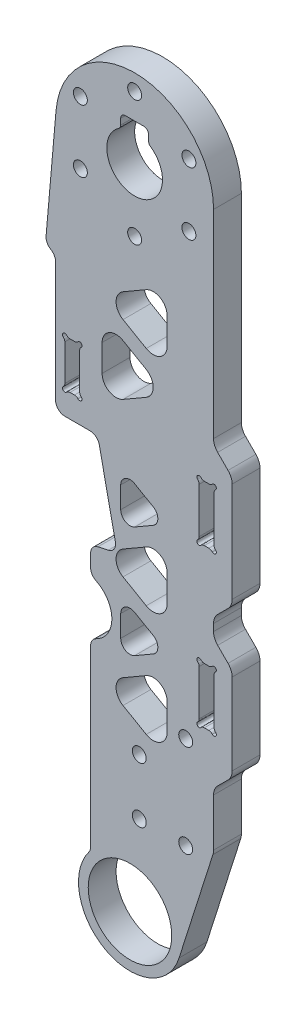
from build123d import *

# Parameters (mm, degrees)
SKETCH_1_R      = 1.5
SKETCH_1_R_2    = 9
EXTRUDE_1_DEPTH = 6


with BuildPart() as part:
    # 草图1 → 凸台-拉伸1 (new body)
    with BuildSketch(Plane(origin=(0, 0, 0), x_dir=(-1, 0, 0), z_dir=(0, 0, -1))):
        with BuildLine():
            Line((32.955703333, 64.324893425), (30.80974204, 88.853343236))
            ThreePointArc((30.80974204, 88.853343236), (13.132902588, 104.355515376), (-3.125567827, 87.371695609))
            Line((-3.125567827, 87.371695609), (-3.125567827, 44.614336296))
            ThreePointArc((-3.125567827, 44.614336296), (-3.35392923, 43.466285999), (-4.004247484, 42.493015952))
            Line((-4.004247484, 42.493015952), (-6.246888171, 40.250375265))
            ThreePointArc((-6.246888171, 40.250375265), (-6.897206425, 39.277105219), (-7.125567827, 38.129054922))
            Line((-7.125567827, 38.129054922), (-7.125567827, 16.614336296))
            ThreePointArc((-7.125567827, 16.614336296), (-6.897206425, 15.466285999), (-6.246888171, 14.493015952))
            Line((-6.246888171, 14.493015952), (-4.004247484, 12.250375265))
            ThreePointArc((-4.004247484, 12.250375265), (-3.35392923, 11.277105219), (-3.125567827, 10.129054922))
            Line((-3.125567827, 10.129054922), (-3.125567827, 8.614336296))
            ThreePointArc((-3.125567827, 8.614336296), (-3.35392923, 7.466285999), (-4.004247484, 6.493015952))
            Line((-4.004247484, 6.493015952), (-6.246888171, 4.250375265))
            ThreePointArc((-6.246888171, 4.250375265), (-6.897206425, 3.277105219), (-7.125567827, 2.129054922))
            Line((-7.125567827, 2.129054922), (-7.125567827, -15.385663704))
            ThreePointArc((-7.125567827, -15.385663704), (-6.897206425, -16.533714001), (-6.246888171, -17.506984048))
            Line((-6.246888171, -17.506984048), (-4.004247484, -19.749624735))
            ThreePointArc((-4.004247484, -19.749624735), (-3.35392923, -20.722894781), (-3.125567827, -21.870945078))
            Line((-3.125567827, -21.870945078), (-3.125567827, -32.162875903))
            ThreePointArc((-3.125567827, -32.162875903), (-3.090102825, -32.62280225), (-2.98454633, -33.071854406))
            Line((-2.98454633, -33.071854406), (4.301916011, -55.989711238))
            ThreePointArc((4.301916011, -55.989711238), (19.95472423, -62.490747628), (23.749643638, -45.971895792))
            ThreePointArc((23.749643638, -45.971895792), (23.452277042, -45.404351324), (23.349643638, -44.771895792))
            Line((23.349643638, -44.771895792), (23.349643638, -7.198720147))
            ThreePointArc((23.349643638, -7.198720147), (23.040438051, -6.130443847), (22.208429387, -5.392484548))
            ThreePointArc((22.208429387, -5.392484548), (18.784786633, 0.026222248), (22.208429387, 5.444929044))
            ThreePointArc((22.208429387, 5.444929044), (23.040438051, 6.182888343), (23.349643638, 7.251164643))
            Line((23.349643638, 7.251164643), (23.349643638, 10.023932997))
            ThreePointArc((23.349643638, 10.023932997), (22.903935561, 11.28257378), (21.765467019, 11.980228199))
            Line((21.765467019, 11.980228199), (19.563528405, 12.4482647))
            ThreePointArc((19.563528405, 12.4482647), (18.30201065, 13.315281831), (18.023056585, 14.820383283))
            Line((18.023056585, 14.820383283), (21.500946505, 31.182568919))
            ThreePointArc((21.500946505, 31.182568919), (22.198600924, 32.32103746), (23.457241706, 32.766745537))
            Line((23.457241706, 32.766745537), (28.907131585, 32.766745537))
            ThreePointArc((28.907131585, 32.766745537), (30.321345148, 33.352531975), (30.907131585, 34.766745537))
            Line((30.907131585, 34.766745537), (30.907131585, 60.619918005))
            ThreePointArc((30.907131585, 60.619918005), (31.129655766, 61.536749347), (31.747711296, 62.249563547))
            ThreePointArc((31.747711296, 62.249563547), (31.948812633, 62.393857493), (32.148749116, 62.539761206))
            ThreePointArc((32.148749116, 62.539761206), (32.785761883, 63.326759457), (32.955703333, 64.324893425))
        make_face()
        with Locations((13.874432173, 100.871695609)):
            Circle(SKETCH_1_R, mode=Mode.SUBTRACT)
        with Locations((2.183089222, 94.121695609)):
            Circle(SKETCH_1_R, mode=Mode.SUBTRACT)
        with Locations((2.183089222, 80.621695609)):
            Circle(SKETCH_1_R, mode=Mode.SUBTRACT)
        with Locations((13.874432173, 73.871695609)):
            Circle(SKETCH_1_R, mode=Mode.SUBTRACT)
        with Locations((25.565775124, 80.621695609)):
            Circle(SKETCH_1_R, mode=Mode.SUBTRACT)
        with Locations((12.874432173, -22.332303749)):
            Circle(SKETCH_1_R, mode=Mode.SUBTRACT)
        with Locations((2.874432173, -14.332303749)):
            Circle(SKETCH_1_R, mode=Mode.SUBTRACT)
        with Locations((12.874432173, -34.332303749)):
            Circle(SKETCH_1_R, mode=Mode.SUBTRACT)
        with Locations((2.874432173, -34.332303749)):
            Circle(SKETCH_1_R, mode=Mode.SUBTRACT)
        with Locations((14.874432173, -52.628304391)):
            Circle(SKETCH_1_R_2, mode=Mode.SUBTRACT)
        with Locations((25.565775124, 94.121695609)):
            Circle(SKETCH_1_R, mode=Mode.SUBTRACT)
        with BuildLine():
            Line((-2.107533838, 35.667696251), (-1.143601816, 35.667696251))
            ThreePointArc((-1.143601816, 35.667696251), (-0.735353525, 35.754825322), (-0.398245823, 36.001029585))
            ThreePointArc((-0.398245823, 36.001029585), (0.327985563, 36.021249642), (0.307765506, 35.295018255))
            ThreePointArc((0.307765506, 35.295018255), (0.061561244, 34.957910553), (-0.025567827, 34.549662262))
            Line((-0.025567827, 34.549662262), (-0.025567827, 24.78573024))
            ThreePointArc((-0.025567827, 24.78573024), (0.061561244, 24.377481949), (0.307765506, 24.040374247))
            ThreePointArc((0.307765506, 24.040374247), (0.327985563, 23.314142861), (-0.398245823, 23.334362918))
            ThreePointArc((-0.398245823, 23.334362918), (-0.735353525, 23.58056718), (-1.143601816, 23.667696251))
            Line((-1.143601816, 23.667696251), (-2.107533838, 23.667696251))
            ThreePointArc((-2.107533838, 23.667696251), (-2.515782129, 23.58056718), (-2.852889831, 23.334362918))
            ThreePointArc((-2.852889831, 23.334362918), (-3.579121218, 23.314142861), (-3.558901161, 24.040374247))
            ThreePointArc((-3.558901161, 24.040374247), (-3.312696898, 24.377481949), (-3.225567827, 24.78573024))
            Line((-3.225567827, 24.78573024), (-3.225567827, 34.549662262))
            ThreePointArc((-3.225567827, 34.549662262), (-3.312696898, 34.957910553), (-3.558901161, 35.295018255))
            ThreePointArc((-3.558901161, 35.295018255), (-3.579121218, 36.021249642), (-2.852889831, 36.001029585))
            ThreePointArc((-2.852889831, 36.001029585), (-2.515782129, 35.754825322), (-2.107533838, 35.667696251))
        make_face(mode=Mode.SUBTRACT)
        with BuildLine():
            Line((10.874432173, 93.116258255), (10.874432173, 94.371695609))
            ThreePointArc((10.874432173, 94.371695609), (11.167325392, 95.07880239), (11.874432173, 95.371695609))
            Line((11.874432173, 95.371695609), (15.874432173, 95.371695609))
            ThreePointArc((15.874432173, 95.371695609), (16.581538954, 95.07880239), (16.874432173, 94.371695609))
            Line((16.874432173, 94.371695609), (16.874432173, 93.116258255))
            ThreePointArc((16.874432173, 93.116258255), (16.988026912, 92.653348206), (17.303003601, 92.295606449))
            ThreePointArc((17.303003601, 92.295606449), (13.874432173, 81.371695609), (10.445860744, 92.295606449))
            ThreePointArc((10.445860744, 92.295606449), (10.760837433, 92.653348206), (10.874432173, 93.116258255))
        make_face(mode=Mode.SUBTRACT)
        with BuildLine():
            Line((11.374432172, 65.152523811), (16.374432175, 62.265772463))
            ThreePointArc((16.374432175, 62.265772463), (17.874432175, 59.667696252), (16.374432175, 57.06962004))
            Line((16.374432175, 57.06962004), (11.374432172, 54.182868693))
            ThreePointArc((11.374432172, 54.182868693), (8.374432172, 54.182868693), (6.874432172, 56.780944904))
            Line((6.874432172, 56.780944904), (6.874432172, 62.5544476))
            ThreePointArc((6.874432172, 62.5544476), (8.374432172, 65.152523811), (11.374432172, 65.152523811))
        make_face(mode=Mode.SUBTRACT)
        with BuildLine():
            Line((6.874432172, 8.780944893), (6.874432172, 14.554447588))
            ThreePointArc((6.874432172, 14.554447588), (8.374432172, 17.1525238), (11.374432172, 17.1525238))
            Line((11.374432172, 17.1525238), (16.374432175, 14.265772452))
            ThreePointArc((16.374432175, 14.265772452), (17.874432175, 11.66769624), (16.374432175, 9.069620029))
            Line((16.374432175, 9.069620029), (11.374432172, 6.182868681))
            ThreePointArc((11.374432172, 6.182868681), (8.374432172, 6.182868681), (6.874432172, 8.780944893))
        make_face(mode=Mode.SUBTRACT)
        with BuildLine():
            Line((13.874432173, -4.373755645), (9.874432172, -2.064354567))
            ThreePointArc((9.874432172, -2.064354567), (8.874432172, -0.33230376), (9.874432172, 1.399747048))
            Line((9.874432172, 1.399747048), (13.874432173, 3.709148125))
            ThreePointArc((13.874432173, 3.709148125), (15.874432173, 3.709148125), (16.874432173, 1.977097318))
            Line((16.874432173, 1.977097318), (16.874432173, -2.641704837))
            ThreePointArc((16.874432173, -2.641704837), (15.874432173, -4.373755645), (13.874432173, -4.373755645))
        make_face(mode=Mode.SUBTRACT)
        with BuildLine():
            Line((6.874432172, -15.219055113), (6.874432172, -9.445552417))
            ThreePointArc((6.874432172, -9.445552417), (8.374432172, -6.847476206), (11.374432172, -6.847476206))
            Line((11.374432172, -6.847476206), (16.374432175, -9.734227554))
            ThreePointArc((16.374432175, -9.734227554), (17.874432175, -12.332303765), (16.374432175, -14.930379977))
            Line((16.374432175, -14.930379977), (11.374432172, -17.817131325))
            ThreePointArc((11.374432172, -17.817131325), (8.374432172, -17.817131325), (6.874432172, -15.219055113))
        make_face(mode=Mode.SUBTRACT)
        with BuildLine():
            Line((9.874432172, 25.399747048), (13.874432173, 27.709148125))
            ThreePointArc((13.874432173, 27.709148125), (15.874432173, 27.709148125), (16.874432173, 25.977097318))
            Line((16.874432173, 25.977097318), (16.874432173, 21.358295163))
            ThreePointArc((16.874432173, 21.358295163), (15.874432173, 19.626244355), (13.874432173, 19.626244355))
            Line((13.874432173, 19.626244355), (9.874432172, 21.935645433))
            ThreePointArc((9.874432172, 21.935645433), (8.874432172, 23.66769624), (9.874432172, 25.399747048))
        make_face(mode=Mode.SUBTRACT)
        with BuildLine():
            Line((20.874432175, 50.554447597), (20.874432175, 44.780944901))
            ThreePointArc((20.874432175, 44.780944901), (19.374432175, 42.18286869), (16.374432175, 42.18286869))
            Line((16.374432175, 42.18286869), (11.374432172, 45.069620038))
            ThreePointArc((11.374432172, 45.069620038), (9.874432172, 47.667696249), (11.374432172, 50.26577246))
            Line((11.374432172, 50.26577246), (16.374432175, 53.152523808))
            ThreePointArc((16.374432175, 53.152523808), (19.374432175, 53.152523808), (20.874432175, 50.554447597))
        make_face(mode=Mode.SUBTRACT)
        with BuildLine():
            Line((-3.225567827, -9.21426976), (-3.225567827, 0.549662262))
            ThreePointArc((-3.225567827, 0.549662262), (-3.312696898, 0.957910553), (-3.558901161, 1.295018255))
            ThreePointArc((-3.558901161, 1.295018255), (-3.579121218, 2.021249642), (-2.852889831, 2.001029585))
            ThreePointArc((-2.852889831, 2.001029585), (-2.515782129, 1.754825322), (-2.107533838, 1.667696251))
            Line((-2.107533838, 1.667696251), (-1.143601816, 1.667696251))
            ThreePointArc((-1.143601816, 1.667696251), (-0.735353525, 1.754825322), (-0.398245823, 2.001029585))
            ThreePointArc((-0.398245823, 2.001029585), (0.327985563, 2.021249642), (0.307765506, 1.295018255))
            ThreePointArc((0.307765506, 1.295018255), (0.061561244, 0.957910553), (-0.025567827, 0.549662262))
            Line((-0.025567827, 0.549662262), (-0.025567827, -9.21426976))
            ThreePointArc((-0.025567827, -9.21426976), (0.061561244, -9.622518051), (0.307765506, -9.959625753))
            ThreePointArc((0.307765506, -9.959625753), (0.327985563, -10.685857139), (-0.398245823, -10.665637082))
            ThreePointArc((-0.398245823, -10.665637082), (-0.735353525, -10.41943282), (-1.143601816, -10.332303749))
            Line((-1.143601816, -10.332303749), (-2.107533838, -10.332303749))
            ThreePointArc((-2.107533838, -10.332303749), (-2.515782129, -10.41943282), (-2.852889831, -10.665637082))
            ThreePointArc((-2.852889831, -10.665637082), (-3.579121218, -10.685857139), (-3.558901161, -9.959625753))
            ThreePointArc((-3.558901161, -9.959625753), (-3.312696898, -9.622518051), (-3.225567827, -9.21426976))
        make_face(mode=Mode.SUBTRACT)
        with BuildLine():
            Line((28.915750484, 46.644779526), (28.915750484, 38.884779526))
            ThreePointArc((28.915750484, 38.884779526), (29.002879555, 38.476531235), (29.249083817, 38.139423533))
            ThreePointArc((29.249083817, 38.139423533), (29.269303874, 37.413192146), (28.543072488, 37.433412204))
            ThreePointArc((28.543072488, 37.433412204), (28.205964786, 37.679616466), (27.797716495, 37.766745537))
            Line((27.797716495, 37.766745537), (26.833784473, 37.766745537))
            ThreePointArc((26.833784473, 37.766745537), (26.425536182, 37.679616466), (26.08842848, 37.433412204))
            ThreePointArc((26.08842848, 37.433412204), (25.362197093, 37.413192146), (25.382417151, 38.139423533))
            ThreePointArc((25.382417151, 38.139423533), (25.628621413, 38.476531235), (25.715750484, 38.884779526))
            Line((25.715750484, 38.884779526), (25.715750484, 46.644779526))
            ThreePointArc((25.715750484, 46.644779526), (25.628621413, 47.053027816), (25.382417151, 47.390135518))
            ThreePointArc((25.382417151, 47.390135518), (25.362197093, 48.116366905), (26.08842848, 48.096146848))
            ThreePointArc((26.08842848, 48.096146848), (26.425536182, 47.849942585), (26.833784473, 47.762813515))
            Line((26.833784473, 47.762813515), (27.797716495, 47.762813515))
            ThreePointArc((27.797716495, 47.762813515), (28.205964786, 47.849942585), (28.543072488, 48.096146848))
            ThreePointArc((28.543072488, 48.096146848), (29.269303874, 48.116366905), (29.249083817, 47.390135518))
            ThreePointArc((29.249083817, 47.390135518), (29.002879555, 47.053027816), (28.915750484, 46.644779526))
        make_face(mode=Mode.SUBTRACT)
    extrude(amount=-EXTRUDE_1_DEPTH)


solid = part.part
